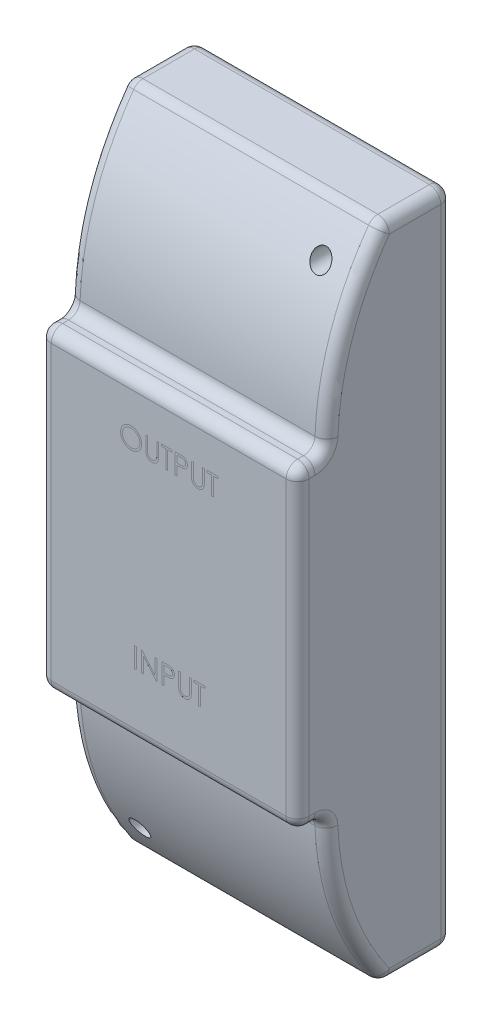
from build123d import *

# Parameters (mm, degrees)
ESQUISSE1_W             = 45
ESQUISSE1_H             = 115
BOSS_EXTRU_1_DEPTH      = 27
ENL_V_MAT_EXTRU_1_DEPTH = 78.847607542
CONG_1_R                = 2
SKETCH1_W               = 0.314102565
SKETCH1_H               = 3.5
CUT_EXTRUDE1_DEPTH      = 0.001
CUT_EXTRUDE2_REACH      = 69.391
SKETCH2_R               = 1.7


with BuildPart() as part:
    # Esquisse1 → Boss.-Extru.1 (new body)
    with BuildSketch(Plane.XY):
        Rectangle(ESQUISSE1_W, ESQUISSE1_H)
    extrude(amount=BOSS_EXTRU_1_DEPTH)

    # Esquisse2 → Enlèv. mat.-Extru.1 (cut, through all)
    with BuildSketch(Plane.ZY.offset(22.5)):
        with BuildLine():
            Line((30.871803653, 27.5), (22, 27.5))
            ThreePointArc((22, 27.5), (19.434164903, 43.311388301), (12, 57.5))
            Line((12, 57.5), (30.871803653, 57.5))
            Line((30.871803653, 57.5), (30.871803653, 27.5))
        make_face()
    enl_v_mat_extru_1 = extrude(amount=-ENL_V_MAT_EXTRU_1_DEPTH, mode=Mode.SUBTRACT)

    # Symétrie1: Enlèv. mat.-Extru.1 across plane
    add(enl_v_mat_extru_1.mirror(Plane.ZX), mode=Mode.SUBTRACT)

    # Congé1
    cong_1_edges = [part.edges().sort_by_distance(p)[0] for p in [
        (-22.5, 0, 27),
        (0, 27.5, 27),
        (-22.5, 57.5, 6),
        (22.5, 57.5, 6),
        (22.5, 27.5, 24.5),
        (22.5, 43.311388301, 19.434164903),
        (0, 27.5, 22),
        (0, 57.5, 12),
        (-22.5, 43.311388301, 19.434164903),
        (-22.5, 27.5, 24.5),
        (22.5, 0, 27),
        (0, -27.5, 27),
        (22.5, -57.5, 6),
        (-22.5, -57.5, 6),
        (-22.5, -43.311388301, 19.434164903),
        (0, -57.5, 12),
        (-22.5, -27.5, 24.5),
        (0, -27.5, 22),
        (22.5, -27.5, 24.5),
        (22.5, -43.311388301, 19.434164903),
        (0, -57.5, 0),
        (-22.5, 0, 0),
        (0, 57.5, 0),
        (22.5, 0, 0),
    ]]
    fillet(cong_1_edges, radius=CONG_1_R)

    # Sketch1 → Cut-Extrude1 (cut)
    # profile 1 of 11: a face of its own
    with BuildSketch(Plane.XY.offset(27)):
        with BuildLine():
            add(Edge.make_bspline(
                [(-6.573717949, 20.011305815), (-6.508909843, 20.009664336), (-6.381621376, 20.006440335), (-6.194546478, 19.981761231), (-6.015951383, 19.939065841), (-5.844381244, 19.882202859), (-5.681888267, 19.806348473), (-5.527249375, 19.714663325), (-5.380832501, 19.606186866), (-5.24461112, 19.481757639), (-5.119954169, 19.346374185), (-5.010128283, 19.201896275), (-4.918085989, 19.049197473), (-4.842500202, 18.888736642), (-4.783201592, 18.720876674), (-4.742282549, 18.544722672), (-4.716144399, 18.361415982), (-4.713088621, 18.236389117), (-4.711538462, 18.172964469)],
                knots=[0, 0, 0, 0, 1.065120563, 2.091984664, 3.0946048, 4.079830382, 5.057816894, 6.036188127, 7.030412546, 8.04752943, 9.064399622, 10.05169764, 11.02544977, 11.989514704, 12.962713494, 13.945757189, 14.957906945, 16, 16, 16, 16], degree=3))
            add(Edge.make_bspline(
                [(-4.711538462, 18.172964469), (-4.713088394, 18.110007022), (-4.716143491, 17.985910602), (-4.742312268, 17.803767158), (-4.783353268, 17.628676461), (-4.841949534, 17.460930809), (-4.917175013, 17.300353245), (-5.009830184, 17.147366291), (-5.118971395, 17.001919793), (-5.243178246, 16.865607127), (-5.378579288, 16.740609657), (-5.523809555, 16.631690781), (-5.675602874, 16.537966656), (-5.835912583, 16.463182982), (-6.002612619, 16.403411062), (-6.177194943, 16.362658432), (-6.358841497, 16.336371389), (-6.4827125, 16.333352873), (-6.545673077, 16.331818635)],
                knots=[0, 0, 0, 0, 1.043624062, 2.057103931, 3.04512605, 4.022047818, 4.998200453, 5.980619268, 6.982898556, 8.009068085, 9.034988726, 10.034168286, 11.015286542, 11.987931943, 12.962482838, 13.94673481, 14.956375938, 16, 16, 16, 16], degree=3))
            add(Edge.make_bspline(
                [(-6.545673077, 16.331818635), (-6.609097396, 16.333368022), (-6.734123612, 16.336422276), (-6.917660647, 16.362603681), (-7.093938391, 16.403544985), (-7.262452742, 16.462054421), (-7.423297672, 16.537671652), (-7.576787755, 16.629876031), (-7.722306902, 16.739283172), (-7.858648648, 16.863449747), (-7.983397846, 16.998621299), (-8.092157222, 17.143455554), (-8.184382335, 17.29511101), (-8.259745668, 17.454008534), (-8.319410127, 17.619379977), (-8.360114945, 17.792328455), (-8.386450898, 17.97186796), (-8.389485744, 18.094110859), (-8.391025641, 18.156137546)],
                knots=[0, 0, 0, 0, 1.053102029, 2.075944431, 3.073151272, 4.055350789, 5.033113405, 6.020478099, 7.024410459, 8.052272461, 9.079885166, 10.07527673, 11.055994387, 12.023226415, 12.992069828, 13.970394897, 14.97016774, 16, 16, 16, 16], degree=3))
            add(Edge.make_bspline(
                [(-8.391025641, 18.156137546), (-8.390491006, 18.197770215), (-8.389428479, 18.280510338), (-8.376636787, 18.403376938), (-8.358075086, 18.524267596), (-8.331473173, 18.642838544), (-8.296681506, 18.758799529), (-8.255629479, 18.872950292), (-8.205489633, 18.984134016), (-8.148808985, 19.092877407), (-8.085547177, 19.197485313), (-8.015671428, 19.296364896), (-7.941636059, 19.390345893), (-7.860472666, 19.476992897), (-7.77485622, 19.558826553), (-7.683397842, 19.63458927), (-7.586655598, 19.704964221), (-7.484213218, 19.768384562), (-7.378594943, 19.825743697), (-7.269718165, 19.874965548), (-7.159061594, 19.917211609), (-7.046106946, 19.951452435), (-6.931154174, 19.978484471), (-6.813952389, 19.996891824), (-6.694594963, 20.009716142), (-6.614183644, 20.010773644), (-6.573717949, 20.011305815)],
                knots=[0, 0, 0, 0, 1.037015668, 2.060948919, 3.074880161, 4.083647147, 5.086022904, 6.090072063, 7.104153813, 8.122640571, 9.144368836, 10.147691507, 11.138137339, 12.123020368, 13.103399296, 14.087645067, 15.080126199, 16.082011238, 17.087798457, 18.072939717, 19.057185487, 20.037253025, 21.01195951, 21.997135196, 22.992090687, 24, 24, 24, 24], degree=3))
        make_face()
        with BuildLine():
            add(Edge.make_bspline(
                [(-6.558293269, 19.652331456), (-6.591507903, 19.651926566), (-6.657619636, 19.651120656), (-6.755904172, 19.64050494), (-6.852896106, 19.625375051), (-6.948615468, 19.603793531), (-7.042661757, 19.574389478), (-7.135911599, 19.54054857), (-7.227514652, 19.499327479), (-7.31716851, 19.452754775), (-7.404083585, 19.401205854), (-7.486096287, 19.344234087), (-7.563418931, 19.283175533), (-7.635862197, 19.217887695), (-7.70321337, 19.148038093), (-7.766798071, 19.074685657), (-7.824067653, 18.995733766), (-7.87655323, 18.913323359), (-7.92352107, 18.827561778), (-7.965286425, 18.739351916), (-7.999450433, 18.647974229), (-8.02731281, 18.554420072), (-8.05041262, 18.458837612), (-8.065046545, 18.360501763), (-8.075778904, 18.259906651), (-8.076538749, 18.191924797), (-8.076923077, 18.157539789)],
                knots=[0, 0, 0, 0, 1.008559885, 2.007477868, 2.99961109, 3.989939068, 4.984837346, 5.991145699, 7.001802488, 8.033829008, 9.059044045, 10.069351652, 11.065060232, 12.050310815, 13.029377138, 14.011219647, 14.996725999, 15.989392538, 16.977580475, 17.965360261, 18.951710183, 19.937753436, 20.929683414, 21.935841486, 22.955955122, 24, 24, 24, 24], degree=3))
            add(Edge.make_bspline(
                [(-8.076923077, 18.157539789), (-8.075648215, 18.106977568), (-8.073140167, 18.007506038), (-8.051182597, 17.861737894), (-8.017360623, 17.721649608), (-7.967503256, 17.588007699), (-7.905152641, 17.459663416), (-7.828125751, 17.337755311), (-7.736866666, 17.222250437), (-7.633203139, 17.113955168), (-7.519880432, 17.015109364), (-7.399547702, 16.928345955), (-7.273494095, 16.854935705), (-7.141390892, 16.795130633), (-7.003943353, 16.747740895), (-6.860265802, 16.715262264), (-6.711315343, 16.693886808), (-6.609784687, 16.691834053), (-6.558293269, 16.690792994)],
                knots=[0, 0, 0, 0, 1.032063989, 2.030389145, 3.003944642, 3.970395727, 4.937377036, 5.913328081, 6.909231446, 7.93887556, 8.970685674, 9.976071282, 10.964166581, 11.944589148, 12.933237628, 13.927779006, 14.949070134, 16, 16, 16, 16], degree=3))
            add(Edge.make_bspline(
                [(-6.558293269, 16.690792994), (-6.523683768, 16.691268499), (-6.455042731, 16.692211567), (-6.352947209, 16.701710244), (-6.252690997, 16.716942113), (-6.154414717, 16.738872769), (-6.058229906, 16.766319975), (-5.963735103, 16.798927703), (-5.871936812, 16.839608907), (-5.781676975, 16.884556858), (-5.695280733, 16.935797016), (-5.612805201, 16.990835165), (-5.536329221, 17.051803786), (-5.463940149, 17.116121599), (-5.39631246, 17.185085447), (-5.333903476, 17.258605668), (-5.276923344, 17.337146326), (-5.224457697, 17.419431731), (-5.177654435, 17.505427984), (-5.136875336, 17.593957662), (-5.10227922, 17.684802771), (-5.074350715, 17.778094343), (-5.052465253, 17.873655192), (-5.037385333, 17.97161327), (-5.026836895, 18.071772612), (-5.026041818, 18.139516468), (-5.025641026, 18.173665591)],
                knots=[0, 0, 0, 0, 1.047197238, 2.076906641, 3.100256066, 4.114471768, 5.12198147, 6.126382909, 7.136867548, 8.15857795, 9.17633901, 10.174870724, 11.156907918, 12.133735059, 13.104061851, 14.077631395, 15.04955518, 16.038496417, 17.029181396, 18.010275684, 18.986308667, 19.968651475, 20.955262928, 21.950658345, 22.966943676, 24, 24, 24, 24], degree=3))
            add(Edge.make_bspline(
                [(-5.025641026, 18.173665591), (-5.026042139, 18.207581095), (-5.02683782, 18.274858745), (-5.037380295, 18.374319563), (-5.052481185, 18.471572775), (-5.074243893, 18.566236578), (-5.102294047, 18.658335103), (-5.136881377, 18.747781851), (-5.177666677, 18.834910046), (-5.224474901, 18.919504343), (-5.277090725, 19.000679081), (-5.334584968, 19.078281493), (-5.397950316, 19.150854235), (-5.465376341, 19.220188929), (-5.538547226, 19.284806818), (-5.61713152, 19.344729339), (-5.700175198, 19.401402613), (-5.788102434, 19.452528175), (-5.878846387, 19.499742408), (-5.971960345, 19.540193411), (-6.066389445, 19.57456553), (-6.161893557, 19.603882495), (-6.259276536, 19.625290525), (-6.357880364, 19.640518575), (-6.457568623, 19.651116961), (-6.524611843, 19.65192534), (-6.558293269, 19.652331456)],
                knots=[0, 0, 0, 0, 1.02996197, 2.043119294, 3.035359645, 4.018872909, 4.991431989, 5.957985074, 6.929999688, 7.912076566, 8.892894881, 9.867085534, 10.843653904, 11.817741046, 12.803660682, 13.806313499, 14.818574707, 15.856120519, 16.894564902, 17.924820532, 18.937903209, 19.946497019, 20.957711757, 21.963978472, 22.977135795, 24, 24, 24, 24], degree=3))
        make_face(mode=Mode.SUBTRACT)
    # profile 2 of 11: a face of its own
    with BuildSketch(Plane.XY.offset(27)):
        with BuildLine():
            Line((-3.993589744, 19.921562225), (-3.679487179, 19.921562225))
            Line((-3.679487179, 19.921562225), (-3.679487179, 17.824506937))
            add(Edge.make_bspline(
                [(-3.679487179, 17.824506937), (-3.679533923, 17.794826201), (-3.679622628, 17.73850189), (-3.679030114, 17.658333589), (-3.677370746, 17.58706113), (-3.676324586, 17.524409783), (-3.673997253, 17.470667035), (-3.672099206, 17.425541725), (-3.669658649, 17.389247522), (-3.666725532, 17.368066596), (-3.665464744, 17.358962065)],
                knots=[0, 0, 0, 0, 1.528628734, 2.90083645, 4.128790002, 5.200304208, 6.127813768, 6.898992206, 7.526736466, 8, 8, 8, 8], degree=3))
            add(Edge.make_bspline(
                [(-3.665464744, 17.358962065), (-3.660287285, 17.326115302), (-3.650224098, 17.262272572), (-3.624577721, 17.171364291), (-3.58876022, 17.089432832), (-3.546317177, 17.013921541), (-3.490384566, 16.946932181), (-3.42338103, 16.885220528), (-3.342203262, 16.831248724), (-3.251942656, 16.781897912), (-3.154657419, 16.74223283), (-3.055246152, 16.712239465), (-2.955203173, 16.693960565), (-2.888227008, 16.691844026), (-2.854967949, 16.690792994)],
                knots=[0, 0, 0, 0, 1.035780045, 2.013197591, 2.933192213, 3.817615948, 4.702609284, 5.640816605, 6.646850145, 7.73207398, 8.84249596, 9.914020372, 10.964143139, 12, 12, 12, 12], degree=3))
            add(Edge.make_bspline(
                [(-2.854967949, 16.690792994), (-2.826414208, 16.691866845), (-2.769471646, 16.694008343), (-2.684865216, 16.707269774), (-2.602465107, 16.73117034), (-2.521864427, 16.762010098), (-2.446313443, 16.802757689), (-2.375770001, 16.849828529), (-2.312806067, 16.905039405), (-2.255348069, 16.966139749), (-2.205313133, 17.035079549), (-2.161941991, 17.110357687), (-2.126416062, 17.193107034), (-2.108872537, 17.251261456), (-2.099859776, 17.281137546)],
                knots=[0, 0, 0, 0, 0.994687771, 1.983630487, 2.973142513, 3.978332533, 4.983357753, 5.956394766, 6.925816176, 7.893390482, 8.871859704, 9.88551698, 10.913711441, 12, 12, 12, 12], degree=3))
            add(Edge.make_bspline(
                [(-2.099859776, 17.281137546), (-2.09685965, 17.29348612), (-2.090174162, 17.32100372), (-2.083927117, 17.367525011), (-2.077420592, 17.422414375), (-2.072906022, 17.486066187), (-2.068504801, 17.55826716), (-2.065871729, 17.639393418), (-2.064654696, 17.729150378), (-2.064292015, 17.79178754), (-2.064102564, 17.824506937)],
                knots=[0, 0, 0, 0, 0.558680831, 1.244966039, 2.062412453, 2.990489873, 4.051219941, 5.244515665, 6.560634259, 8, 8, 8, 8], degree=3))
            Line((-2.064102564, 17.824506937), (-2.064102564, 19.921562225))
            Line((-2.064102564, 19.921562225), (-1.75, 19.921562225))
            Line((-1.75, 19.921562225), (-1.75, 17.807680014))
            add(Edge.make_bspline(
                [(-1.75, 17.807680014), (-1.75025412, 17.769581635), (-1.750750052, 17.695230332), (-1.755050628, 17.586278973), (-1.761907628, 17.482925991), (-1.771595716, 17.385157495), (-1.784432719, 17.293323336), (-1.79870794, 17.206618568), (-1.816887473, 17.125665575), (-1.838120874, 17.049833157), (-1.862394422, 16.977647644), (-1.89383557, 16.909139029), (-1.92926007, 16.84222463), (-1.971274723, 16.777916521), (-2.018486106, 16.715929967), (-2.071937787, 16.656640892), (-2.129861948, 16.599101846), (-2.193221507, 16.54478878), (-2.260972032, 16.494980103), (-2.33291199, 16.451182332), (-2.40848876, 16.414158715), (-2.487505886, 16.38368279), (-2.569997089, 16.360768191), (-2.655964449, 16.343693035), (-2.745603642, 16.333990738), (-2.806568298, 16.332548808), (-2.837439904, 16.331818635)],
                knots=[0, 0, 0, 0, 1.316592851, 2.569410997, 3.76748051, 4.895814652, 5.963796859, 6.97159953, 7.931736103, 8.829262218, 9.692595152, 10.560224239, 11.431080259, 12.30701507, 13.211635791, 14.121146779, 15.063487852, 16.031507147, 17.00238618, 17.966455255, 18.938106653, 19.907068911, 20.888905087, 21.893141452, 22.933117798, 24, 24, 24, 24], degree=3))
            add(Edge.make_bspline(
                [(-2.837439904, 16.331818635), (-2.871109006, 16.332603401), (-2.937167665, 16.334143107), (-3.034505733, 16.342965857), (-3.127819929, 16.359584252), (-3.218095806, 16.380744196), (-3.304104303, 16.409927933), (-3.386997747, 16.444026058), (-3.465356429, 16.485903318), (-3.540451557, 16.532496711), (-3.610276313, 16.584921349), (-3.674373716, 16.642061523), (-3.732849587, 16.7030019), (-3.784718283, 16.768402266), (-3.830839168, 16.837753973), (-3.870569381, 16.911253213), (-3.904682625, 16.988871529), (-3.922289193, 17.04282473), (-3.931189904, 17.070099885)],
                knots=[0, 0, 0, 0, 1.13879206, 2.234305948, 3.301075583, 4.341971843, 5.366689343, 6.369221514, 7.369726634, 8.367512178, 9.355451585, 10.318319045, 11.268648973, 12.207971039, 13.137398894, 14.081662264, 15.030215811, 16, 16, 16, 16], degree=3))
            add(Edge.make_bspline(
                [(-3.931189904, 17.070099885), (-3.936367062, 17.08873246), (-3.947596433, 17.129146929), (-3.959621731, 17.196033417), (-3.969730813, 17.273048335), (-3.979236371, 17.360196953), (-3.984845329, 17.45754682), (-3.989762768, 17.565055736), (-3.993624386, 17.682853698), (-3.993601614, 17.764908213), (-3.993589744, 17.807680014)],
                knots=[0, 0, 0, 0, 0.625038921, 1.35572334, 2.194682327, 3.136881307, 4.189498639, 5.346923369, 6.617055217, 8, 8, 8, 8], degree=3))
            Line((-3.993589744, 17.807680014), (-3.993589744, 19.921562225))
        make_face()
    # profile 3 of 11: a face of its own
    with BuildSketch(Plane.XY.offset(27)):
        Polygon((-1.256410256, 19.562587866), (-1.256410256, 19.921562225), (0.583333333, 19.921562225), (0.583333333, 19.562587866), (-0.179487179, 19.562587866), (-0.179487179, 16.421562225), (-0.493589744, 16.421562225), (-0.493589744, 19.562587866), align=None)
    # profile 4 of 11: a face of its own
    with BuildSketch(Plane.XY.offset(27)):
        with BuildLine():
            Line((1.121794872, 19.921562225), (1.808193109, 19.921562225))
            add(Edge.make_bspline(
                [(1.808193109, 19.921562225), (1.855404015, 19.921510329), (1.945862208, 19.921410893), (2.075577264, 19.918396148), (2.193386995, 19.914369456), (2.299037376, 19.908787562), (2.392853474, 19.902190972), (2.474410774, 19.892938933), (2.54435033, 19.883278637), (2.58625678, 19.873457231), (2.60536859, 19.868978091)],
                knots=[0, 0, 0, 0, 1.415646017, 2.712440637, 3.8905458, 4.950247383, 5.884950622, 6.709939814, 7.411656543, 8, 8, 8, 8], degree=3))
            add(Edge.make_bspline(
                [(2.60536859, 19.868978091), (2.629562124, 19.862356141), (2.677379101, 19.849268279), (2.746280144, 19.823054556), (2.811833989, 19.79197239), (2.874265548, 19.756548451), (2.932807631, 19.715262886), (2.988333672, 19.669789269), (3.040353652, 19.6190777), (3.088575044, 19.56369696), (3.132859842, 19.50457675), (3.170989524, 19.44083452), (3.202916751, 19.373543217), (3.230300023, 19.302749646), (3.250008477, 19.227859322), (3.264855377, 19.14939261), (3.274279005, 19.06735792), (3.275181566, 19.011298052), (3.275641026, 18.982760142)],
                knots=[0, 0, 0, 0, 0.999701418, 1.975846123, 2.934577507, 3.890451536, 4.834027766, 5.787354733, 6.749476667, 7.726910423, 8.712836071, 9.690891519, 10.682875813, 11.679750201, 12.712814741, 13.765529915, 14.8625177, 16, 16, 16, 16], degree=3))
            add(Edge.make_bspline(
                [(3.275641026, 18.982760142), (3.275219601, 18.953982365), (3.274395055, 18.897676701), (3.26449877, 18.815303913), (3.251168578, 18.736585523), (3.230671526, 18.661696072), (3.203825853, 18.591080302), (3.1723338, 18.52365907), (3.134350269, 18.460579398), (3.09070544, 18.40161228), (3.042153845, 18.346702368), (2.988900907, 18.296247574), (2.931161615, 18.250543235), (2.869119467, 18.209486891), (2.802169618, 18.174030612), (2.731327464, 18.142273307), (2.655977248, 18.115602246), (2.603834734, 18.101572185), (2.577323718, 18.094438828)],
                knots=[0, 0, 0, 0, 1.121902311, 2.195077645, 3.232258892, 4.234102512, 5.217864754, 6.176164875, 7.132989551, 8.084763148, 9.034132444, 9.988522005, 10.94243251, 11.903244335, 12.886203696, 13.894208494, 14.929344452, 16, 16, 16, 16], degree=3))
            add(Edge.make_bspline(
                [(2.577323718, 18.094438828), (2.555396384, 18.089775847), (2.507341357, 18.079556653), (2.428198634, 18.068148196), (2.336053248, 18.058410595), (2.231030969, 18.051109457), (2.113226064, 18.044859089), (1.982574806, 18.039890995), (1.838820729, 18.037161141), (1.738549485, 18.037020348), (1.686197917, 18.036946841)],
                knots=[0, 0, 0, 0, 0.601384939, 1.31797006, 2.144135048, 3.087295005, 4.142315834, 5.309527816, 6.595305764, 8, 8, 8, 8], degree=3))
            Line((1.686197917, 18.036946841), (1.435897436, 18.036946841))
            Line((1.435897436, 18.036946841), (1.435897436, 16.421562225))
            Line((1.435897436, 16.421562225), (1.121794872, 16.421562225))
            Line((1.121794872, 16.421562225), (1.121794872, 19.921562225))
        make_face()
        with BuildLine():
            Line((1.435897436, 19.562587866), (1.435897436, 18.3959212))
            Line((1.435897436, 18.3959212), (2.048677885, 18.38820886))
            add(Edge.make_bspline(
                [(2.048677885, 18.38820886), (2.07859781, 18.388193396), (2.13635761, 18.388163544), (2.219793834, 18.392148768), (2.297203121, 18.3967493), (2.368347696, 18.403485224), (2.433259631, 18.413006481), (2.49204716, 18.422618219), (2.544254443, 18.436523582), (2.605353644, 18.455246651), (2.673436992, 18.487179266), (2.74750454, 18.533529157), (2.810275127, 18.592609865), (2.864593423, 18.659037696), (2.907699301, 18.732936825), (2.939255294, 18.812005762), (2.957796451, 18.895433612), (2.960282645, 18.952521751), (2.961538462, 18.981357898)],
                knots=[0, 0, 0, 0, 1.160613943, 2.240541288, 3.23993089, 4.169200891, 5.011653406, 5.7853311, 6.478053781, 7.106038997, 8.262395093, 9.384106736, 10.481365981, 11.59014053, 12.70357646, 13.786202915, 14.881775077, 16, 16, 16, 16], degree=3))
            add(Edge.make_bspline(
                [(2.961538462, 18.981357898), (2.960275815, 19.009496412), (2.95776583, 19.065432294), (2.939109967, 19.147411054), (2.907760653, 19.225646759), (2.864304059, 19.298619844), (2.811562929, 19.364808648), (2.750263585, 19.422305775), (2.680550324, 19.468527478), (2.615702093, 19.49836076), (2.558100907, 19.516576035), (2.508068947, 19.529320876), (2.451578273, 19.539496482), (2.388610493, 19.547735985), (2.319653659, 19.554789446), (2.244115344, 19.559575423), (2.162281701, 19.562376879), (2.10547113, 19.562515835), (2.076021635, 19.562587866)],
                knots=[0, 0, 0, 0, 1.120700087, 2.227813068, 3.331159281, 4.466773991, 5.599788987, 6.693661531, 7.80175334, 8.91857717, 9.525282508, 10.207424825, 10.974604443, 11.810962634, 12.737642355, 13.736264703, 14.826523623, 16, 16, 16, 16], degree=3))
            Line((2.076021635, 19.562587866), (1.435897436, 19.562587866))
        make_face(mode=Mode.SUBTRACT)
    # profile 5 of 11: a face of its own
    with BuildSketch(Plane.XY.offset(27)):
        with BuildLine():
            Line((3.993589744, 19.921562225), (4.307692308, 19.921562225))
            Line((4.307692308, 19.921562225), (4.307692308, 17.824506937))
            add(Edge.make_bspline(
                [(4.307692308, 17.824506937), (4.307645564, 17.794826201), (4.307556859, 17.73850189), (4.308149373, 17.658333589), (4.309808741, 17.58706113), (4.310854901, 17.524409783), (4.313182234, 17.470667035), (4.315080281, 17.425541725), (4.317520838, 17.389247522), (4.320453955, 17.368066596), (4.321714744, 17.358962065)],
                knots=[0, 0, 0, 0, 1.528628734, 2.90083645, 4.128790002, 5.200304208, 6.127813768, 6.898992206, 7.526736466, 8, 8, 8, 8], degree=3))
            add(Edge.make_bspline(
                [(4.321714744, 17.358962065), (4.326892202, 17.326115302), (4.336955389, 17.262272572), (4.362601767, 17.171364291), (4.398419268, 17.089432832), (4.44086231, 17.013921541), (4.496794922, 16.946932181), (4.563798457, 16.885220528), (4.644976225, 16.831248724), (4.735236831, 16.781897912), (4.832522069, 16.74223283), (4.931933335, 16.712239465), (5.031976314, 16.693960565), (5.098952479, 16.691844026), (5.132211538, 16.690792994)],
                knots=[0, 0, 0, 0, 1.035780045, 2.013197591, 2.933192213, 3.817615948, 4.702609284, 5.640816605, 6.646850145, 7.73207398, 8.84249596, 9.914020372, 10.964143139, 12, 12, 12, 12], degree=3))
            add(Edge.make_bspline(
                [(5.132211538, 16.690792994), (5.160765279, 16.691866845), (5.217707841, 16.694008343), (5.302314271, 16.707269774), (5.38471438, 16.73117034), (5.46531506, 16.762010098), (5.540866044, 16.802757689), (5.611409486, 16.849828529), (5.674373421, 16.905039405), (5.731831418, 16.966139749), (5.781866354, 17.035079549), (5.825237496, 17.110357687), (5.860763426, 17.193107034), (5.87830695, 17.251261456), (5.887319712, 17.281137546)],
                knots=[0, 0, 0, 0, 0.994687771, 1.983630487, 2.973142513, 3.978332533, 4.983357753, 5.956394766, 6.925816176, 7.893390482, 8.871859704, 9.88551698, 10.913711441, 12, 12, 12, 12], degree=3))
            add(Edge.make_bspline(
                [(5.887319712, 17.281137546), (5.890319837, 17.29348612), (5.897005325, 17.32100372), (5.90325237, 17.367525011), (5.909758895, 17.422414375), (5.914273465, 17.486066187), (5.918674686, 17.55826716), (5.921307759, 17.639393418), (5.922524792, 17.729150378), (5.922887472, 17.79178754), (5.923076923, 17.824506937)],
                knots=[0, 0, 0, 0, 0.558680831, 1.244966039, 2.062412453, 2.990489873, 4.051219941, 5.244515665, 6.560634259, 8, 8, 8, 8], degree=3))
            Line((5.923076923, 17.824506937), (5.923076923, 19.921562225))
            Line((5.923076923, 19.921562225), (6.237179487, 19.921562225))
            Line((6.237179487, 19.921562225), (6.237179487, 17.807680014))
            add(Edge.make_bspline(
                [(6.237179487, 17.807680014), (6.236925367, 17.769581635), (6.236429435, 17.695230332), (6.232128859, 17.586278973), (6.225271859, 17.482925991), (6.215583771, 17.385157495), (6.202746768, 17.293323336), (6.188471547, 17.206618568), (6.170292014, 17.125665575), (6.149058613, 17.049833157), (6.124785065, 16.977647644), (6.093343917, 16.909139029), (6.057919417, 16.84222463), (6.015904764, 16.777916521), (5.968693381, 16.715929967), (5.915241701, 16.656640892), (5.85731754, 16.599101846), (5.79395798, 16.54478878), (5.726207455, 16.494980103), (5.654267497, 16.451182332), (5.578690727, 16.414158715), (5.499673601, 16.38368279), (5.417182398, 16.360768191), (5.331215039, 16.343693035), (5.241575845, 16.333990738), (5.180611189, 16.332548808), (5.149739583, 16.331818635)],
                knots=[0, 0, 0, 0, 1.316592851, 2.569410997, 3.76748051, 4.895814652, 5.963796859, 6.97159953, 7.931736103, 8.829262218, 9.692595152, 10.560224239, 11.431080259, 12.30701507, 13.211635791, 14.121146779, 15.063487852, 16.031507147, 17.00238618, 17.966455255, 18.938106653, 19.907068911, 20.888905087, 21.893141452, 22.933117798, 24, 24, 24, 24], degree=3))
            add(Edge.make_bspline(
                [(5.149739583, 16.331818635), (5.116070481, 16.332603401), (5.050011822, 16.334143107), (4.952673755, 16.342965857), (4.859359558, 16.359584252), (4.769083681, 16.380744196), (4.683075184, 16.409927933), (4.60018174, 16.444026058), (4.521823059, 16.485903318), (4.44672793, 16.532496711), (4.376903174, 16.584921349), (4.312805771, 16.642061523), (4.2543299, 16.7030019), (4.202461204, 16.768402266), (4.156340319, 16.837753973), (4.116610106, 16.911253213), (4.082496862, 16.988871529), (4.064890295, 17.04282473), (4.055989583, 17.070099885)],
                knots=[0, 0, 0, 0, 1.13879206, 2.234305948, 3.301075583, 4.341971843, 5.366689343, 6.369221514, 7.369726634, 8.367512178, 9.355451585, 10.318319045, 11.268648973, 12.207971039, 13.137398894, 14.081662264, 15.030215811, 16, 16, 16, 16], degree=3))
            add(Edge.make_bspline(
                [(4.055989583, 17.070099885), (4.050812425, 17.08873246), (4.039583054, 17.129146929), (4.027557756, 17.196033417), (4.017448674, 17.273048335), (4.007943116, 17.360196953), (4.002334158, 17.45754682), (3.99741672, 17.565055736), (3.993555101, 17.682853698), (3.993577873, 17.764908213), (3.993589744, 17.807680014)],
                knots=[0, 0, 0, 0, 0.625038921, 1.35572334, 2.194682327, 3.136881307, 4.189498639, 5.346923369, 6.617055217, 8, 8, 8, 8], degree=3))
            Line((3.993589744, 17.807680014), (3.993589744, 19.921562225))
        make_face()
    # profile 6 of 11: a face of its own
    with BuildSketch(Plane.XY.offset(27)):
        Polygon((6.730769231, 19.562587866), (6.730769231, 19.921562225), (8.570512821, 19.921562225), (8.570512821, 19.562587866), (7.807692308, 19.562587866), (7.807692308, 16.421562225), (7.493589744, 16.421562225), (7.493589744, 19.562587866), align=None)
    # profile 7 of 11: a face of its own
    with BuildSketch(Plane.XY.offset(27)):
        with Locations((-5.788461539, -14.671562225)):
            Rectangle(SKETCH1_W, SKETCH1_H)
    # profile 8 of 11: a face of its own
    with BuildSketch(Plane.XY.offset(27)):
        Polygon((-4.733974359, -16.421562225), (-4.733974359, -12.921562225), (-4.66806891, -12.921562225), (-2.355769231, -15.676269757), (-2.355769231, -12.921562225), (-2.041666667, -12.921562225), (-2.041666667, -16.421562225), (-2.11318109, -16.421562225), (-4.419871795, -13.673164789), (-4.419871795, -16.421562225), align=None)
    # profile 9 of 11: a face of its own
    with BuildSketch(Plane.XY.offset(27)):
        with BuildLine():
            Line((-1.144230769, -12.921562225), (-0.457832532, -12.921562225))
            add(Edge.make_bspline(
                [(-0.457832532, -12.921562225), (-0.410621626, -12.921614121), (-0.320163433, -12.921713557), (-0.190448377, -12.924728303), (-0.072638646, -12.928754995), (0.033011735, -12.934336888), (0.126827833, -12.940933478), (0.208385133, -12.950185518), (0.278324689, -12.959845813), (0.320231139, -12.96966722), (0.339342949, -12.97414636)],
                knots=[0, 0, 0, 0, 1.415646017, 2.712440637, 3.8905458, 4.950247383, 5.884950622, 6.709939814, 7.411656543, 8, 8, 8, 8], degree=3))
            add(Edge.make_bspline(
                [(0.339342949, -12.97414636), (0.363536483, -12.98076831), (0.41135346, -12.993856171), (0.480254503, -13.020069895), (0.545808348, -13.05115206), (0.608239907, -13.086576), (0.66678199, -13.127861564), (0.722308031, -13.173335182), (0.774328011, -13.22404675), (0.822549403, -13.27942749), (0.866834201, -13.3385477), (0.904963883, -13.40228993), (0.93689111, -13.469581233), (0.964274382, -13.540374805), (0.983982836, -13.615265128), (0.998829736, -13.69373184), (1.008253364, -13.775766531), (1.009155925, -13.831826398), (1.009615385, -13.860364309)],
                knots=[0, 0, 0, 0, 0.999701418, 1.975846123, 2.934577507, 3.890451536, 4.834027766, 5.787354733, 6.749476667, 7.726910423, 8.712836071, 9.690891519, 10.682875813, 11.679750201, 12.712814741, 13.765529915, 14.8625177, 16, 16, 16, 16], degree=3))
            add(Edge.make_bspline(
                [(1.009615385, -13.860364309), (1.00919396, -13.889142085), (1.008369414, -13.945447749), (0.998473129, -14.027820537), (0.985142937, -14.106538928), (0.964645885, -14.181428378), (0.937800212, -14.252044149), (0.906308159, -14.319465381), (0.868324628, -14.382545052), (0.824679799, -14.44151217), (0.776128204, -14.496422082), (0.722875266, -14.546876877), (0.665135974, -14.592581215), (0.603093826, -14.633637559), (0.536143977, -14.669093838), (0.465301823, -14.700851143), (0.389951607, -14.727522204), (0.337809093, -14.741552265), (0.311298077, -14.748685623)],
                knots=[0, 0, 0, 0, 1.121902311, 2.195077645, 3.232258892, 4.234102512, 5.217864754, 6.176164875, 7.132989551, 8.084763148, 9.034132444, 9.988522005, 10.94243251, 11.903244335, 12.886203696, 13.894208494, 14.929344452, 16, 16, 16, 16], degree=3))
            add(Edge.make_bspline(
                [(0.311298077, -14.748685623), (0.289370743, -14.753348604), (0.241315716, -14.763567798), (0.162172993, -14.774976255), (0.070027607, -14.784713855), (-0.034994672, -14.792014993), (-0.152799577, -14.798265361), (-0.283450835, -14.803233455), (-0.427204912, -14.805963309), (-0.527476156, -14.806104102), (-0.579827724, -14.80617761)],
                knots=[0, 0, 0, 0, 0.601384939, 1.31797006, 2.144135048, 3.087295005, 4.142315834, 5.309527816, 6.595305764, 8, 8, 8, 8], degree=3))
            Line((-0.579827724, -14.80617761), (-0.830128205, -14.80617761))
            Line((-0.830128205, -14.80617761), (-0.830128205, -16.421562225))
            Line((-0.830128205, -16.421562225), (-1.144230769, -16.421562225))
            Line((-1.144230769, -16.421562225), (-1.144230769, -12.921562225))
        make_face()
        with BuildLine():
            Line((-0.830128205, -13.280536584), (-0.830128205, -14.447203251))
            Line((-0.830128205, -14.447203251), (-0.217347756, -14.454915591))
            add(Edge.make_bspline(
                [(-0.217347756, -14.454915591), (-0.187427831, -14.454931054), (-0.129668031, -14.454960906), (-0.046231807, -14.450975683), (0.03117748, -14.44637515), (0.102322055, -14.439639227), (0.16723399, -14.430117969), (0.226021519, -14.420506231), (0.278228801, -14.406600869), (0.339328003, -14.3878778), (0.407411351, -14.355945184), (0.481478899, -14.309595294), (0.544249486, -14.250514586), (0.598567782, -14.184086754), (0.64167366, -14.110187625), (0.673229653, -14.031118688), (0.69177081, -13.947690839), (0.694257004, -13.8906027), (0.695512821, -13.861766552)],
                knots=[0, 0, 0, 0, 1.160613943, 2.240541288, 3.23993089, 4.169200891, 5.011653406, 5.7853311, 6.478053781, 7.106038997, 8.262395093, 9.384106736, 10.481365981, 11.59014053, 12.70357646, 13.786202915, 14.881775077, 16, 16, 16, 16], degree=3))
            add(Edge.make_bspline(
                [(0.695512821, -13.861766552), (0.694250174, -13.833628039), (0.691740189, -13.777692157), (0.673084326, -13.695713396), (0.641735012, -13.617477692), (0.598278418, -13.544504606), (0.545537288, -13.478315802), (0.484237944, -13.420818675), (0.414524683, -13.374596972), (0.349676452, -13.344763691), (0.292075266, -13.326548415), (0.242043306, -13.313803575), (0.185552632, -13.303627969), (0.122584852, -13.295388466), (0.053628018, -13.288335005), (-0.021910297, -13.283549027), (-0.10374394, -13.280747571), (-0.160554511, -13.280608616), (-0.190004006, -13.280536584)],
                knots=[0, 0, 0, 0, 1.120700087, 2.227813068, 3.331159281, 4.466773991, 5.599788987, 6.693661531, 7.80175334, 8.91857717, 9.525282508, 10.207424825, 10.974604443, 11.810962634, 12.737642355, 13.736264703, 14.826523623, 16, 16, 16, 16], degree=3))
            Line((-0.190004006, -13.280536584), (-0.830128205, -13.280536584))
        make_face(mode=Mode.SUBTRACT)
    # profile 10 of 11: a face of its own
    with BuildSketch(Plane.XY.offset(27)):
        with BuildLine():
            Line((1.727564103, -12.921562225), (2.041666667, -12.921562225))
            Line((2.041666667, -12.921562225), (2.041666667, -15.018617514))
            add(Edge.make_bspline(
                [(2.041666667, -15.018617514), (2.041619923, -15.048298249), (2.041531218, -15.10462256), (2.042123732, -15.184790861), (2.0437831, -15.25606332), (2.04482926, -15.318714667), (2.047156593, -15.372457415), (2.04905464, -15.417582726), (2.051495197, -15.453876928), (2.054428314, -15.475057854), (2.055689103, -15.484162385)],
                knots=[0, 0, 0, 0, 1.528628734, 2.90083645, 4.128790002, 5.200304208, 6.127813768, 6.898992206, 7.526736466, 8, 8, 8, 8], degree=3))
            add(Edge.make_bspline(
                [(2.055689103, -15.484162385), (2.060866561, -15.517009149), (2.070929748, -15.580851878), (2.096576125, -15.67176016), (2.132393626, -15.753691618), (2.174836669, -15.829202909), (2.230769281, -15.896192269), (2.297772816, -15.957903922), (2.378950584, -16.011875727), (2.46921119, -16.061226538), (2.566496428, -16.100891621), (2.665907694, -16.130884985), (2.765950673, -16.149163885), (2.832926838, -16.151280424), (2.866185897, -16.152331456)],
                knots=[0, 0, 0, 0, 1.035780045, 2.013197591, 2.933192213, 3.817615948, 4.702609284, 5.640816605, 6.646850145, 7.73207398, 8.84249596, 9.914020372, 10.964143139, 12, 12, 12, 12], degree=3))
            add(Edge.make_bspline(
                [(2.866185897, -16.152331456), (2.894739638, -16.151257606), (2.9516822, -16.149116107), (3.03628863, -16.135854676), (3.118688739, -16.111954111), (3.199289419, -16.081114352), (3.274840403, -16.040366761), (3.345383845, -15.993295922), (3.40834778, -15.938085046), (3.465805777, -15.876984701), (3.515840713, -15.808044901), (3.559211855, -15.732766763), (3.594737785, -15.650017416), (3.612281309, -15.591862994), (3.621294071, -15.561986905)],
                knots=[0, 0, 0, 0, 0.994687771, 1.983630487, 2.973142513, 3.978332533, 4.983357753, 5.956394766, 6.925816176, 7.893390482, 8.871859704, 9.88551698, 10.913711441, 12, 12, 12, 12], degree=3))
            add(Edge.make_bspline(
                [(3.621294071, -15.561986905), (3.624294196, -15.54963833), (3.630979684, -15.52212073), (3.637226729, -15.47559944), (3.643733254, -15.420710076), (3.648247824, -15.357058263), (3.652649045, -15.28485729), (3.655282118, -15.203731033), (3.656499151, -15.113974072), (3.656861831, -15.05133691), (3.657051282, -15.018617514)],
                knots=[0, 0, 0, 0, 0.558680831, 1.244966039, 2.062412453, 2.990489873, 4.051219941, 5.244515665, 6.560634259, 8, 8, 8, 8], degree=3))
            Line((3.657051282, -15.018617514), (3.657051282, -12.921562225))
            Line((3.657051282, -12.921562225), (3.971153846, -12.921562225))
            Line((3.971153846, -12.921562225), (3.971153846, -15.035444437))
            add(Edge.make_bspline(
                [(3.971153846, -15.035444437), (3.970899726, -15.073542816), (3.970403794, -15.147894119), (3.966103218, -15.256845478), (3.959246218, -15.360198459), (3.94955813, -15.457966955), (3.936721127, -15.549801115), (3.922445906, -15.636505883), (3.904266373, -15.717458875), (3.883032972, -15.793291293), (3.858759424, -15.865476807), (3.827318276, -15.933985421), (3.791893776, -16.000899821), (3.749879123, -16.06520793), (3.70266774, -16.127194483), (3.64921606, -16.186483558), (3.591291899, -16.244022604), (3.527932339, -16.29833567), (3.460181814, -16.348144347), (3.388241856, -16.391942118), (3.312665086, -16.428965736), (3.23364796, -16.45944166), (3.151156757, -16.482356259), (3.065189398, -16.499431415), (2.975550204, -16.509133713), (2.914585548, -16.510575643), (2.883713942, -16.511305815)],
                knots=[0, 0, 0, 0, 1.316592851, 2.569410997, 3.76748051, 4.895814652, 5.963796859, 6.97159953, 7.931736103, 8.829262218, 9.692595152, 10.560224239, 11.431080259, 12.30701507, 13.211635791, 14.121146779, 15.063487852, 16.031507147, 17.00238618, 17.966455255, 18.938106653, 19.907068911, 20.888905087, 21.893141452, 22.933117798, 24, 24, 24, 24], degree=3))
            add(Edge.make_bspline(
                [(2.883713942, -16.511305815), (2.85004484, -16.51052105), (2.783986181, -16.508981343), (2.686648114, -16.500158593), (2.593333917, -16.483540199), (2.50305804, -16.462380255), (2.417049543, -16.433196518), (2.334156099, -16.399098393), (2.255797418, -16.357221132), (2.180702289, -16.310627739), (2.110877533, -16.258203101), (2.04678013, -16.201062927), (1.988304259, -16.14012255), (1.936435563, -16.074722184), (1.890314678, -16.005370477), (1.850584465, -15.931871237), (1.816471221, -15.854252921), (1.798864654, -15.800299721), (1.789963942, -15.773024565)],
                knots=[0, 0, 0, 0, 1.13879206, 2.234305948, 3.301075583, 4.341971843, 5.366689343, 6.369221514, 7.369726634, 8.367512178, 9.355451585, 10.318319045, 11.268648973, 12.207971039, 13.137398894, 14.081662264, 15.030215811, 16, 16, 16, 16], degree=3))
            add(Edge.make_bspline(
                [(1.789963942, -15.773024565), (1.784786784, -15.75439199), (1.773557413, -15.713977522), (1.761532115, -15.647091033), (1.751423033, -15.570076115), (1.741917475, -15.482927497), (1.736308517, -15.38557763), (1.731391079, -15.278068714), (1.72752946, -15.160270753), (1.727552232, -15.078216237), (1.727564103, -15.035444437)],
                knots=[0, 0, 0, 0, 0.625038921, 1.35572334, 2.194682327, 3.136881307, 4.189498639, 5.346923369, 6.617055217, 8, 8, 8, 8], degree=3))
            Line((1.727564103, -15.035444437), (1.727564103, -12.921562225))
        make_face()
    # profile 11 of 11: a face of its own
    with BuildSketch(Plane.XY.offset(27)):
        Polygon((4.46474359, -13.280536584), (4.46474359, -12.921562225), (6.304487179, -12.921562225), (6.304487179, -13.280536584), (5.541666667, -13.280536584), (5.541666667, -16.421562225), (5.227564103, -16.421562225), (5.227564103, -13.280536584), align=None)
    extrude(amount=-CUT_EXTRUDE1_DEPTH, mode=Mode.SUBTRACT)

    # Sketch2 → Cut-Extrude2 (cut, up to next)
    with BuildSketch(Plane(origin=(0, 0, 0), x_dir=(-1, 0, 0), z_dir=(0, 0, -1)), mode=Mode.PRIVATE) as cut_extrude2_sk1:
        with Locations((-15.8, 50.8)):
            Circle(SKETCH2_R)
    cut_extrude2_tool1 = extrude(cut_extrude2_sk1.sketch, amount=-CUT_EXTRUDE2_REACH, mode=Mode.PRIVATE) & part.part
    # Sketch2 → Cut-Extrude2 (cut, up to next)
    with BuildSketch(Plane(origin=(0, 0, 0), x_dir=(-1, 0, 0), z_dir=(0, 0, -1)), mode=Mode.PRIVATE) as cut_extrude2_sk2:
        with Locations((15.8, -50.8)):
            Circle(SKETCH2_R)
    cut_extrude2_tool2 = extrude(cut_extrude2_sk2.sketch, amount=-CUT_EXTRUDE2_REACH, mode=Mode.PRIVATE) & part.part
    add(cut_extrude2_tool1.solids().sort_by_distance((15.8, 50.8, 0))[0], mode=Mode.SUBTRACT)
    add(cut_extrude2_tool2.solids().sort_by_distance((-15.8, -50.8, 0))[0], mode=Mode.SUBTRACT)


solid = part.part
